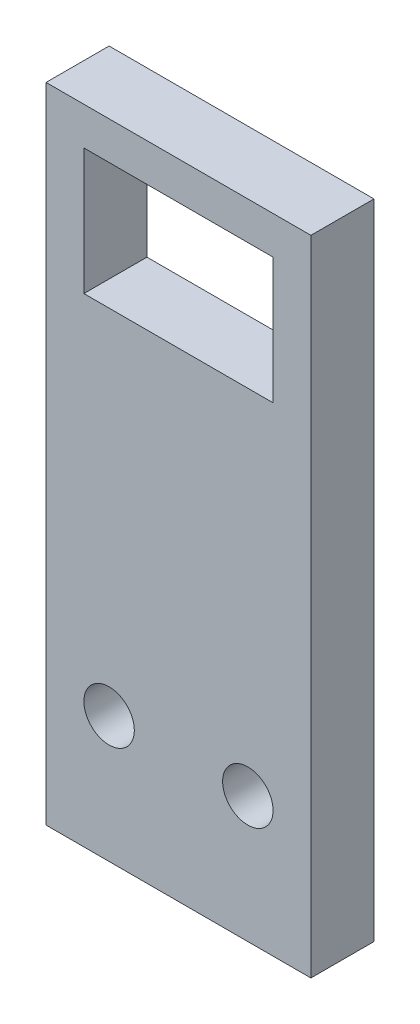
from build123d import *

# Parameters (mm, degrees)
SKETCH1_W           = 21
SKETCH1_H           = 51
SKETCH1_R           = 2
SKETCH1_W_2         = 15
SKETCH1_H_2         = 10
BOSS_EXTRUDE1_DEPTH = 5


with BuildPart() as part:
    # Sketch1 → Boss-Extrude1 (new body)
    with BuildSketch(Plane.XY):
        with Locations((10.5, 25.5)):
            Rectangle(SKETCH1_W, SKETCH1_H)
        with Locations((5, 10)):
            Circle(SKETCH1_R, mode=Mode.SUBTRACT)
        with Locations((16, 10)):
            Circle(SKETCH1_R, mode=Mode.SUBTRACT)
        with Locations((10.5, 43)):
            Rectangle(SKETCH1_W_2, SKETCH1_H_2, mode=Mode.SUBTRACT)
    extrude(amount=BOSS_EXTRUDE1_DEPTH)


solid = part.part
